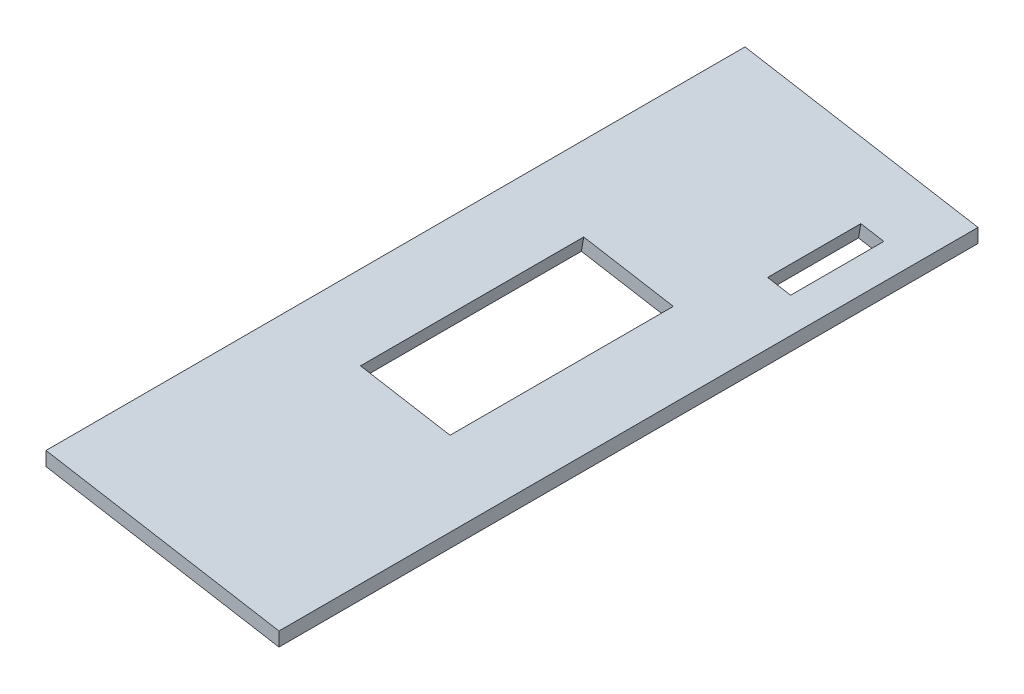
from build123d import *

# Parameters (mm, degrees)
BOSS_EXTRUDE1_DEPTH = 300
SKETCH3_W           = 39
SKETCH3_H           = 95.8
CUT_EXTRUDE2_DEPTH  = 15
SKETCH5_W           = 10
SKETCH5_H           = 40
CUT_EXTRUDE3_DEPTH  = 10


with BuildPart() as part:
    # Sketch2 → Boss-Extrude1 (new body)
    with BuildSketch(Plane.XY):
        Polygon((68.204834584, -44.523707756), (68.204834584, -38.523707756), (-31.795165416, -21.430394722), (-31.795165416, -27.430394722), align=None)
    extrude(amount=BOSS_EXTRUDE1_DEPTH)

    # Sketch3 → Cut-Extrude2 (cut)
    with BuildSketch(Plane(origin=(-4.461794575, -26.102573363, 0), x_dir=(0.9857034690888548, -0.1684893795649959, 0), z_dir=(0.16848937956499588, 0.9857034690888546, 0))):
        with Locations((22.995383369, -147.9)):
            Rectangle(SKETCH3_W, SKETCH3_H)
    extrude(amount=-CUT_EXTRUDE2_DEPTH, mode=Mode.SUBTRACT)

    # Sketch5 → Cut-Extrude3 (cut)
    with BuildSketch(Plane(origin=(-4.461794575, -26.102573363, 0), x_dir=(0.9857034690888548, -0.16848937956499582, 0), z_dir=(0.16848937956499585, 0.9857034690888549, 0))):
        with Locations((55.720577677, -47.61631705)):
            Rectangle(SKETCH5_W, SKETCH5_H)
    extrude(amount=-CUT_EXTRUDE3_DEPTH, mode=Mode.SUBTRACT)


solid = part.part
